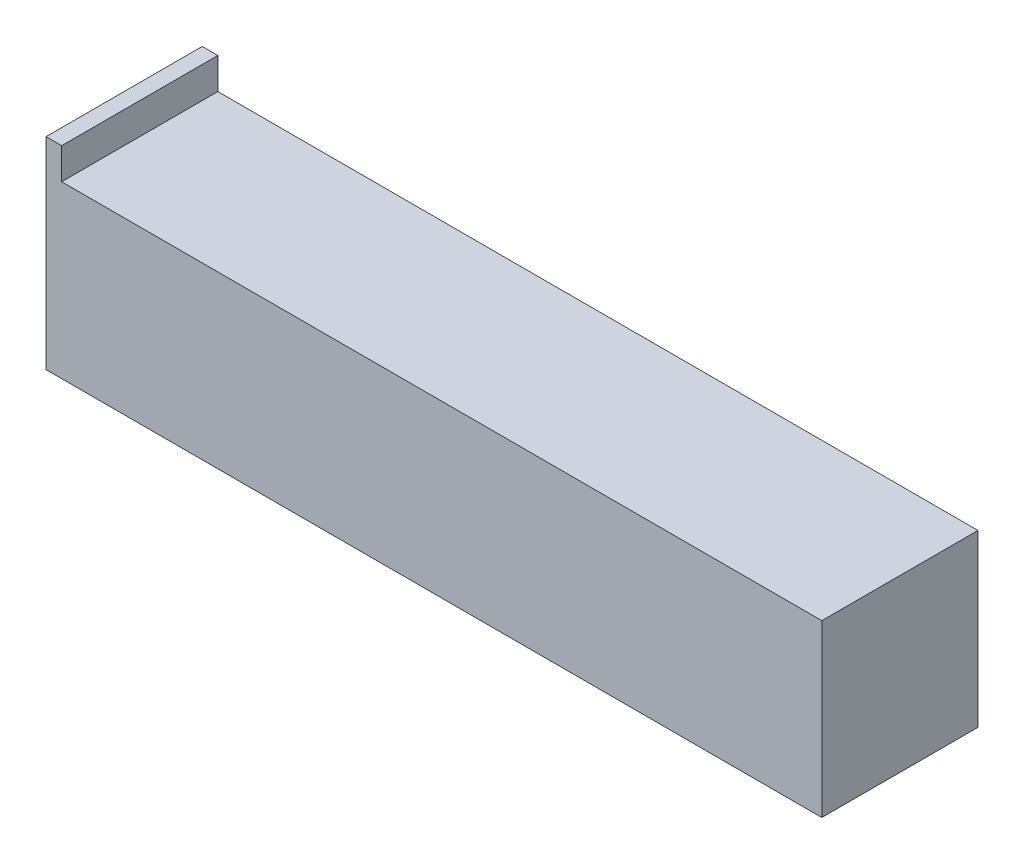
from build123d import *

# Parameters (mm, degrees)
SKETCH1_W           = 75.692
SKETCH1_H           = 16.637
SKETCH1_W_2         = 1.524
SKETCH1_H_2         = 3.048
BOSS_EXTRUDE1_DEPTH = 15.24


with BuildPart() as part:
    # Sketch1 → Boss-Extrude1 (new body)
    with BuildSketch(Plane.XY):
        with Locations((37.846, -8.3185)):
            Rectangle(SKETCH1_W, SKETCH1_H)
        with Locations((0.762, 1.524)):
            Rectangle(SKETCH1_W_2, SKETCH1_H_2)
    extrude(amount=BOSS_EXTRUDE1_DEPTH)


solid = part.part
